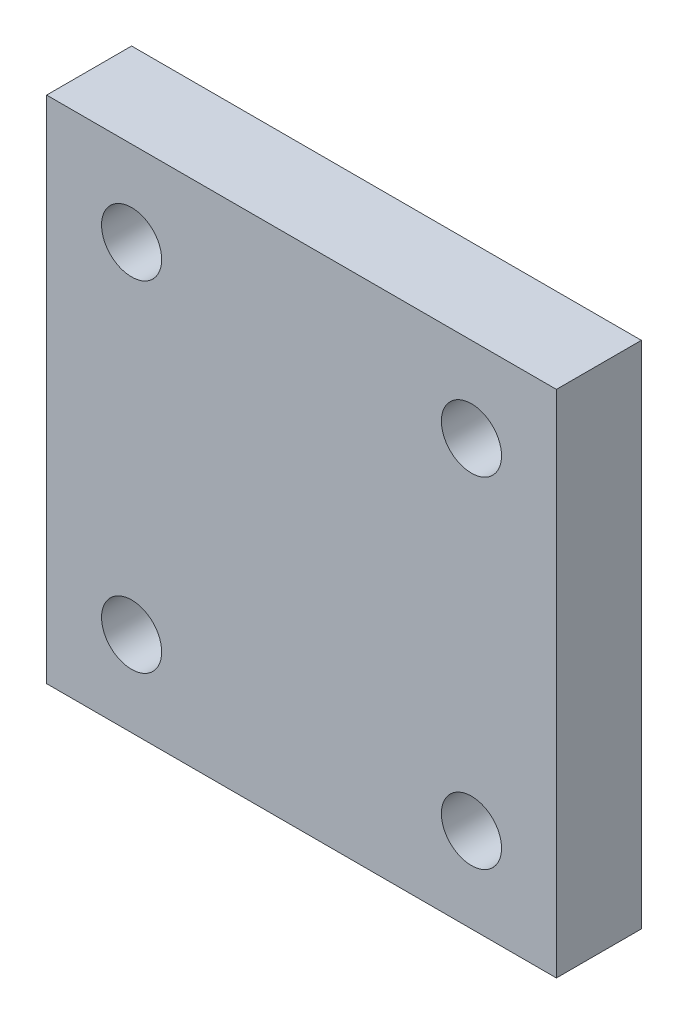
from build123d import *

# Parameters (mm, degrees)
SKETCH1_W           = 38.1
SKETCH1_H           = 38.1
SKETCH1_R           = 2.2479
BOSS_EXTRUDE1_DEPTH = 6.35


with BuildPart() as part:
    # Sketch1 → Boss-Extrude1 (new body)
    with BuildSketch(Plane.XY):
        Rectangle(SKETCH1_W, SKETCH1_H)
        with Locations((-12.7, 12.7)):
            Circle(SKETCH1_R, mode=Mode.SUBTRACT)
        with Locations((12.7, 12.7)):
            Circle(SKETCH1_R, mode=Mode.SUBTRACT)
        with Locations((12.7, -12.7)):
            Circle(SKETCH1_R, mode=Mode.SUBTRACT)
        with Locations((-12.7, -12.7)):
            Circle(SKETCH1_R, mode=Mode.SUBTRACT)
    extrude(amount=BOSS_EXTRUDE1_DEPTH)


solid = part.part
